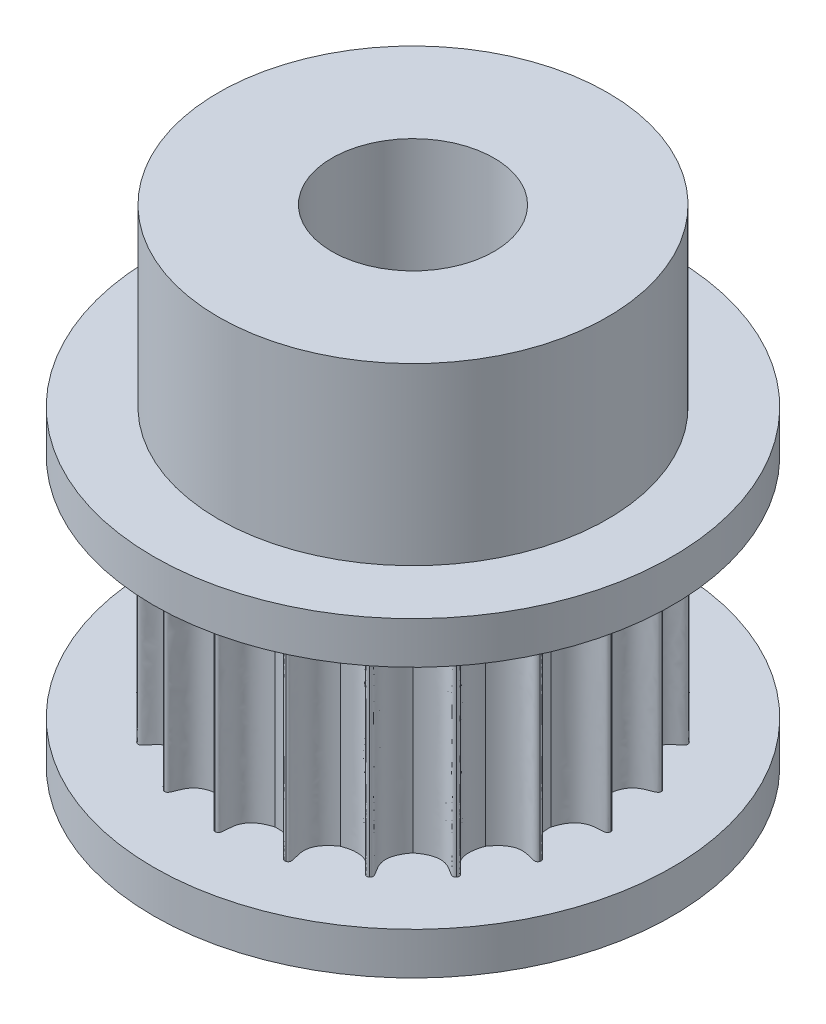
from build123d import *

# Parameters (mm, degrees)
SKETCH1_R           = 8
BOSS_EXTRUDE1_DEPTH = 1.3
SKETCH4_R           = 5.099466978
BOSS_EXTRUDE3_DEPTH = 7
BOSS_EXTRUDE2_DEPTH = 7
CIRPATTERN1_COUNT   = 20
SKETCH5_R           = 8
BOSS_EXTRUDE4_DEPTH = 1.3
SKETCH6_R           = 6
BOSS_EXTRUDE5_DEPTH = 5.4
CUT_EXTRUDE1_REACH  = 20.788
SKETCH7_R           = 2.5


with BuildPart() as part:
    # Sketch1 → Boss-Extrude1 (new body)
    with BuildSketch(Plane(origin=(0, 0, 0), x_dir=(1, 0, 0), z_dir=(0, 1, 0))):
        with Locations(Location((0, 0, 0), (0, 0, 270))):
            Circle(SKETCH1_R)
    extrude(amount=BOSS_EXTRUDE1_DEPTH)

    # Sketch4 → Boss-Extrude3 (add)
    with BuildSketch(Plane(origin=(0, 1.3, 0), x_dir=(1, 0, 0), z_dir=(0, 1, 0))):
        with Locations(Location((0, 0, 0), (0, 0, 270))):
            Circle(SKETCH4_R)
    extrude(amount=BOSS_EXTRUDE3_DEPTH)

    # Sketch2 → Boss-Extrude2 (add)
    with BuildSketch(Plane(origin=(0, 1.3, 0), x_dir=(1, 0, 0), z_dir=(0, 1, 0))):
        with BuildLine():
            Line((1, 5.0009999), (-1, 5.0009999))
            add(Edge.make_bspline(
                [(0, 6.1), (-0.309739321, 6.093592301), (0.277259436, 5.251593977), (-1, 5.0009999)],
                knots=[0, 0, 0, 0, 1, 1, 1, 1], degree=3))
            add(Edge.make_bspline(
                [(0, 6.1), (0.309739321, 6.093592301), (-0.277259436, 5.251593977), (1, 5.0009999)],
                knots=[0, 0, 0, 0, 1, 1, 1, 1], degree=3))
        make_face()
    boss_extrude2 = extrude(amount=BOSS_EXTRUDE2_DEPTH)

    # CirPattern1: Boss-Extrude2 ×20 about axis
    cirpattern1_axis = Axis((0, 1.3, 0), (0, -1, 0))
    for i in range(1, CIRPATTERN1_COUNT):
        add(boss_extrude2.rotate(cirpattern1_axis, i * 360 / CIRPATTERN1_COUNT))

    # Sketch5 → Boss-Extrude4 (add)
    with BuildSketch(Plane(origin=(0, 8.3, 0), x_dir=(1, 0, 0), z_dir=(0, 1, 0))):
        with Locations(Location((0, 0, 0), (0, 0, 270))):
            Circle(SKETCH5_R)
    extrude(amount=BOSS_EXTRUDE4_DEPTH)

    # Sketch6 → Boss-Extrude5 (add)
    with BuildSketch(Plane(origin=(0, 9.6, 0), x_dir=(1, 0, 0), z_dir=(0, 1, 0))):
        with Locations(Location((0, 0, 0), (0, 0, 90))):
            Circle(SKETCH6_R)
    extrude(amount=BOSS_EXTRUDE5_DEPTH)

    # Sketch7 → Cut-Extrude1 (cut, up to next)
    with BuildSketch(Plane(origin=(0, 15, 0), x_dir=(1, 0, 0), z_dir=(0, 1, 0)), mode=Mode.PRIVATE) as cut_extrude1_sk1:
        with Locations(Location((0, 0, 0), (0, 0, 270))):
            Circle(SKETCH7_R)
    cut_extrude1_tool1 = extrude(cut_extrude1_sk1.sketch, amount=-CUT_EXTRUDE1_REACH, mode=Mode.PRIVATE) & part.part
    add(cut_extrude1_tool1.solids().sort_by_distance((0, 15, 0))[0], mode=Mode.SUBTRACT)


solid = part.part
